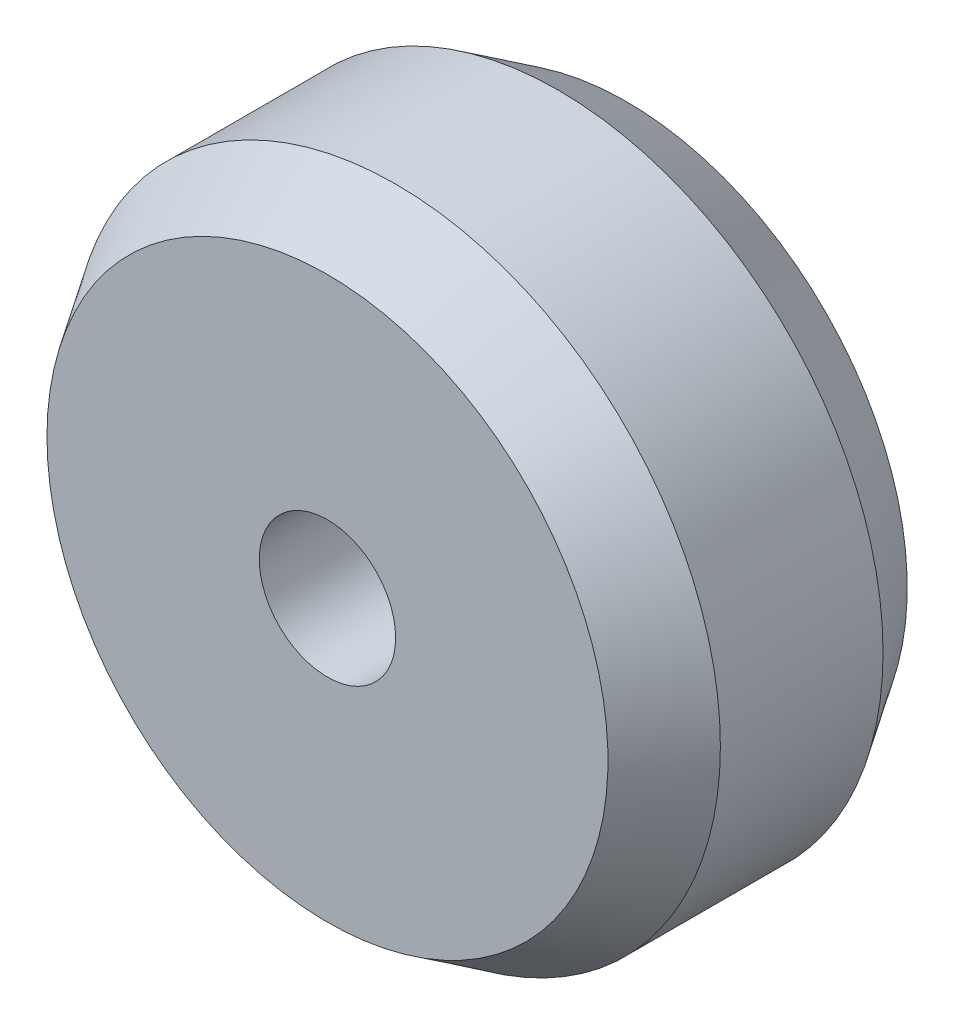
from build123d import *

# Parameters (mm, degrees)
SKETCH1_R           = 11.975
BOSS_EXTRUDE1_DEPTH = 11.04
SKETCH2_R           = 2.515
CUT_EXTRUDE1_DEPTH  = 11.04


with BuildPart() as part:
    # Sketch1 → Boss-Extrude1 (new body)
    with BuildSketch(Plane.XY):
        Circle(SKETCH1_R)
    extrude(amount=BOSS_EXTRUDE1_DEPTH)

    # Sketch2 → Cut-Extrude1 (cut)
    with BuildSketch(Plane.XY):
        Circle(SKETCH2_R)
    extrude(amount=CUT_EXTRUDE1_DEPTH, mode=Mode.SUBTRACT)

    # Sketch3 → Cut-Revolve4 (revolve, cut)
    with BuildSketch(Plane(origin=(0, 0, 0), x_dir=(1, 0, 0), z_dir=(0, 1, 0))):
        Polygon((-7.292190974, 0), (-10.347240804, 0), (-11.975, -2.52), (-11.975, -8.52), (-10.347240804, -11.04), (-6.458257889, -11.04), (-5.810000317, -18.325003181), (-21.89407965, -6.340173639), (-13.168343432, 5.370083322), align=None)
    revolve(axis=Axis((0, 0, -5.854641455), (0, 0, 1)), mode=Mode.SUBTRACT)


solid = part.part
